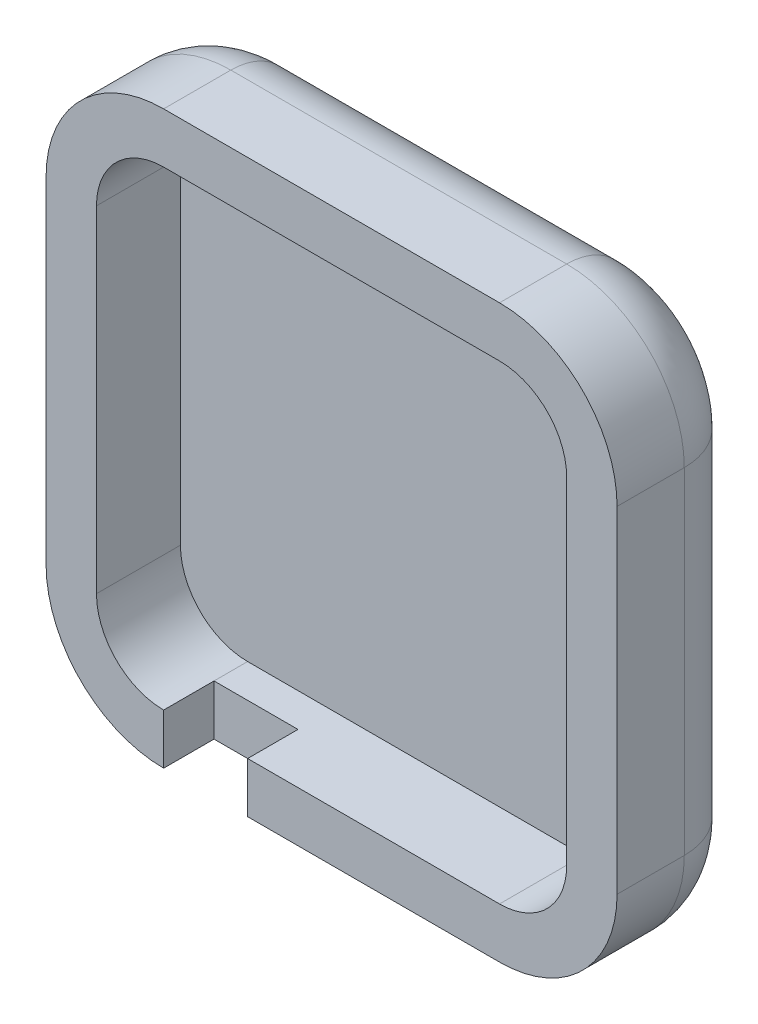
from build123d import *

# Parameters (mm, degrees)
SKETCH1_W           = 17
SKETCH1_H           = 17
BOSS_EXTRUDE1_DEPTH = 4
SKETCH2_W           = 14
SKETCH2_H           = 14
CUT_EXTRUDE1_DEPTH  = 2.5
FILLET1_R           = 2
FILLET2_R           = 3.5
SKETCH3_W           = 2.5
SKETCH3_H           = 1.5
CUT_EXTRUDE2_DEPTH  = 1.5
FILLET3_R           = 2


with BuildPart() as part:
    # Sketch1 → Boss-Extrude1 (new body)
    with BuildSketch(Plane.XY):
        with Locations((8.5, 8.5)):
            Rectangle(SKETCH1_W, SKETCH1_H)
    extrude(amount=BOSS_EXTRUDE1_DEPTH)

    # Sketch2 → Cut-Extrude1 (cut)
    with BuildSketch(Plane.XY.offset(4)):
        with Locations((8.5, 8.5)):
            Rectangle(SKETCH2_W, SKETCH2_H)
    extrude(amount=-CUT_EXTRUDE1_DEPTH, mode=Mode.SUBTRACT)

    # Fillet1
    fillet1_edges = [part.edges().sort_by_distance(p)[0] for p in [
        (1.5, 1.5, 2.75),
        (1.5, 15.5, 2.75),
        (15.5, 15.5, 2.75),
        (15.5, 1.5, 2.75),
    ]]
    fillet(fillet1_edges, radius=FILLET1_R)

    # Fillet2
    fillet2_edges = [part.edges().sort_by_distance(p)[0] for p in [
        (0, 17, 2),
        (17, 17, 2),
        (17, 0, 2),
        (0, 0, 2),
    ]]
    fillet(fillet2_edges, radius=FILLET2_R)

    # Sketch3 → Cut-Extrude2 (cut)
    with BuildSketch(Plane.XY.offset(4)):
        with Locations((4.75, 0.75)):
            Rectangle(SKETCH3_W, SKETCH3_H)
    extrude(amount=-CUT_EXTRUDE2_DEPTH, mode=Mode.SUBTRACT)

    # Fillet3
    fillet3_edges = [part.edges().sort_by_distance(p)[0] for p in [
        (17, 8.5, 0),
        (0, 8.5, 0),
        (8.5, 17, 0),
        (8.5, 0, 0),
        (1.025126266, 15.974873734, 0),
        (15.974873734, 15.974873734, 0),
        (1.025126266, 1.025126266, 0),
        (15.974873734, 1.025126266, 0),
    ]]
    fillet(fillet3_edges, radius=FILLET3_R)


solid = part.part
